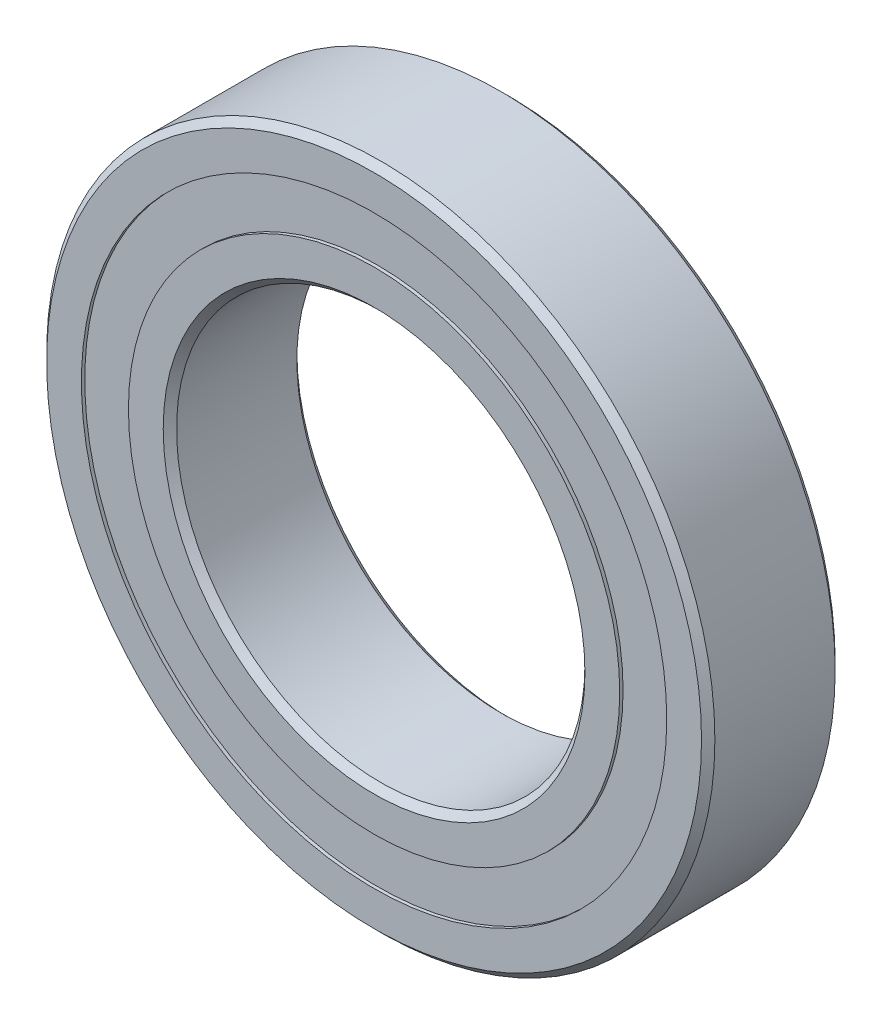
from build123d import *

# Parameters (mm, degrees)
CIRPATTERN1_COUNT = 12
SKETCH5_W         = 3.449393995
SKETCH5_H         = 6.32967033


with BuildPart() as part:
    # Sketch1 → Revolve1 (revolve)
    with BuildSketch(Plane(origin=(0, 0, 0), x_dir=(0, 0, -1), z_dir=(1, 0, 0))):
        with BuildLine():
            Line((8.1, 45), (-8.1, 45))
            Line((-8.1, 45), (-9, 44.1))
            Line((-9, 44.1), (-9, 39.414835165))
            Line((-9, 39.414835165), (-4, 39.414835165))
            ThreePointArc((-4, 39.414835165), (0, 41.350606005), (4, 39.414835165))
            Line((4, 39.414835165), (9, 39.414835165))
            Line((9, 39.414835165), (9, 44.1))
            Line((9, 44.1), (8.1, 45))
        make_face()
    revolve(axis=Axis((0, 0, 9), (0, 0, -1)))


with BuildPart() as body_2:
    # Sketch3 → Revolve3 (revolve)
    with BuildSketch(Plane(origin=(0, 0, 0), x_dir=(0, 0, -1), z_dir=(1, 0, 0))):
        with BuildLine():
            Line((-9, 33.085164835), (-4, 33.085164835))
            ThreePointArc((-4, 33.085164835), (0, 31.149393995), (4, 33.085164835))
            Line((4, 33.085164835), (9, 33.085164835))
            Line((9, 33.085164835), (9, 28.4))
            Line((9, 28.4), (8.1, 27.5))
            Line((8.1, 27.5), (-8.1, 27.5))
            Line((-8.1, 27.5), (-9, 28.4))
            Line((-9, 28.4), (-9, 33.085164835))
        make_face()
    revolve(axis=Axis((0, 0, 9), (0, 0, -1)))


with BuildPart() as body_3:
    # Sketch4 → Revolve4 (revolve)
    with BuildSketch(Plane(origin=(0, 0, 0), x_dir=(0, 0, -1), z_dir=(1, 0, 0))):
        with BuildLine():
            Line((-5.100606005, 36.25), (5.100606005, 36.25))
            ThreePointArc((5.100606005, 36.25), (0, 41.350606005), (-5.100606005, 36.25))
        make_face()
    revolve(axis=Axis((0, 36.25, 5.100606005), (0, 0, -1)))


with BuildPart() as cirpattern1_1:
    # CirPattern1: pattern copy
    add(body_3.part.rotate(Axis((0, 0, -9), (0, 0, 1)), 1 * 360 / CIRPATTERN1_COUNT))


with BuildPart() as cirpattern1_2:
    # CirPattern1: pattern copy
    add(body_3.part.rotate(Axis((0, 0, -9), (0, 0, 1)), 2 * 360 / CIRPATTERN1_COUNT))


with BuildPart() as cirpattern1_3:
    # CirPattern1: pattern copy
    add(body_3.part.rotate(Axis((0, 0, -9), (0, 0, 1)), 3 * 360 / CIRPATTERN1_COUNT))


with BuildPart() as cirpattern1_4:
    # CirPattern1: pattern copy
    add(body_3.part.rotate(Axis((0, 0, -9), (0, 0, 1)), 4 * 360 / CIRPATTERN1_COUNT))


with BuildPart() as cirpattern1_5:
    # CirPattern1: pattern copy
    add(body_3.part.rotate(Axis((0, 0, -9), (0, 0, 1)), 5 * 360 / CIRPATTERN1_COUNT))


with BuildPart() as cirpattern1_6:
    # CirPattern1: pattern copy
    add(body_3.part.rotate(Axis((0, 0, -9), (0, 0, 1)), 6 * 360 / CIRPATTERN1_COUNT))


with BuildPart() as cirpattern1_7:
    # CirPattern1: pattern copy
    add(body_3.part.rotate(Axis((0, 0, -9), (0, 0, 1)), 7 * 360 / CIRPATTERN1_COUNT))


with BuildPart() as cirpattern1_8:
    # CirPattern1: pattern copy
    add(body_3.part.rotate(Axis((0, 0, -9), (0, 0, 1)), 8 * 360 / CIRPATTERN1_COUNT))


with BuildPart() as cirpattern1_9:
    # CirPattern1: pattern copy
    add(body_3.part.rotate(Axis((0, 0, -9), (0, 0, 1)), 9 * 360 / CIRPATTERN1_COUNT))


with BuildPart() as cirpattern1_10:
    # CirPattern1: pattern copy
    add(body_3.part.rotate(Axis((0, 0, -9), (0, 0, 1)), 10 * 360 / CIRPATTERN1_COUNT))


with BuildPart() as cirpattern1_11:
    # CirPattern1: pattern copy
    add(body_3.part.rotate(Axis((0, 0, -9), (0, 0, 1)), 11 * 360 / CIRPATTERN1_COUNT))


with BuildPart() as body_15:
    # Sketch5 → Revolve5 (revolve)
    with BuildSketch(Plane(origin=(0, 0, 0), x_dir=(0, 0, -1), z_dir=(1, 0, 0))):
        with Locations((-6.825303003, 36.25)):
            Rectangle(SKETCH5_W, SKETCH5_H)
        with Locations((6.825303003, 36.25)):
            Rectangle(SKETCH5_W, SKETCH5_H)
    revolve(axis=Axis((0, 0, 9), (0, 0, -1)))


solid = Compound([part.part, body_2.part, body_3.part, cirpattern1_1.part, cirpattern1_2.part, cirpattern1_3.part, cirpattern1_4.part, cirpattern1_5.part, cirpattern1_6.part, cirpattern1_7.part, cirpattern1_8.part, cirpattern1_9.part, cirpattern1_10.part, cirpattern1_11.part, body_15.part])
